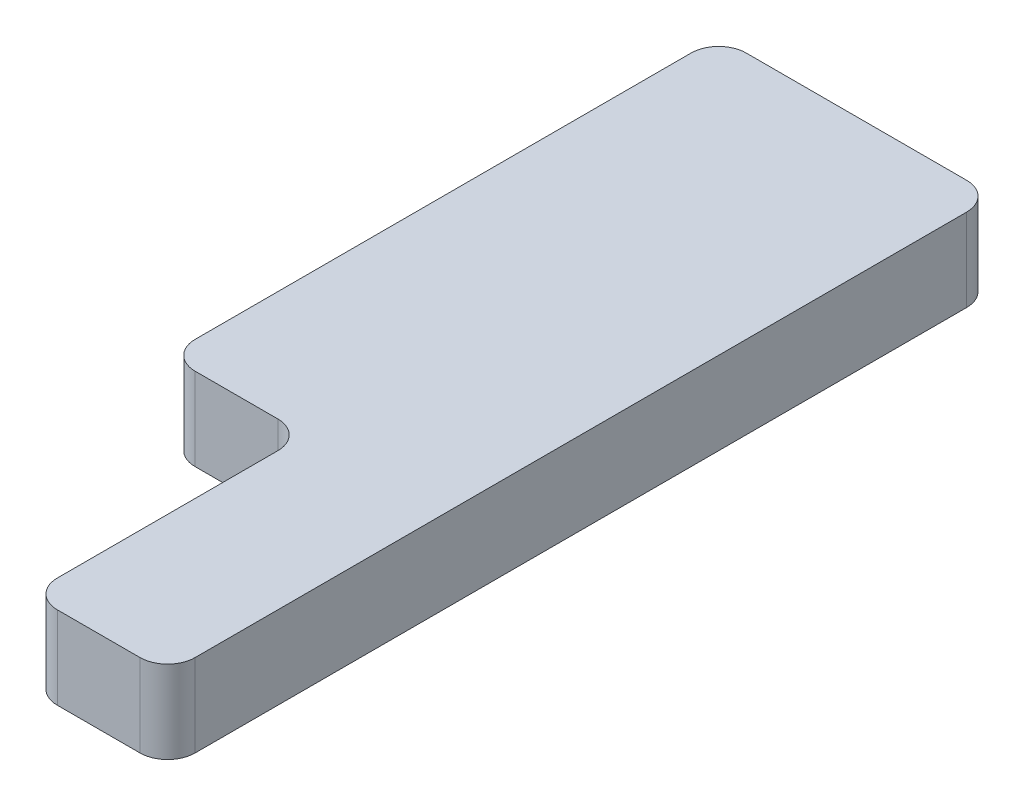
from build123d import *

# Parameters (mm, degrees)
ESBO_O1_W                = 10
ESBO_O1_H                = 30
RESSALTO_EXTRUS_O1_DEPTH = 3
ESBO_O2_W                = 5
ESBO_O2_H                = 10
CORTE_EXTRUS_O1_DEPTH    = 3
FILETE1_R                = 1
FILETE2_R                = 1
FILETE3_R                = 1
FILETE4_R                = 1
FILETE5_R                = 1
FILETE6_R                = 1


with BuildPart() as part:
    # Esboço1 → Ressalto-extrusão1 (new body)
    with BuildSketch(Plane(origin=(0, 0, 0), x_dir=(1, 0, 0), z_dir=(0, 1, 0))):
        Rectangle(ESBO_O1_W, ESBO_O1_H)
    extrude(amount=RESSALTO_EXTRUS_O1_DEPTH)

    # Esboço2 → Corte-extrusão1 (cut)
    with BuildSketch(Plane(origin=(0, 3, 0), x_dir=(1, 0, 0), z_dir=(0, 1, 0))):
        with Locations((-2.5, -10)):
            Rectangle(ESBO_O2_W, ESBO_O2_H)
    extrude(amount=-CORTE_EXTRUS_O1_DEPTH, mode=Mode.SUBTRACT)

    # Filete1
    filete1_edges = [part.edges().sort_by_distance(p)[0] for p in [
        (5, 1.5, 15),
    ]]
    fillet(filete1_edges, radius=FILETE1_R)

    # Filete2
    filete2_edges = [part.edges().sort_by_distance(p)[0] for p in [
        (0, 1.5, 15),
    ]]
    fillet(filete2_edges, radius=FILETE2_R)

    # Filete3
    filete3_edges = [part.edges().sort_by_distance(p)[0] for p in [
        (0, 1.5, 5),
    ]]
    fillet(filete3_edges, radius=FILETE3_R)

    # Filete4
    filete4_edges = [part.edges().sort_by_distance(p)[0] for p in [
        (-5, 1.5, 5),
    ]]
    fillet(filete4_edges, radius=FILETE4_R)

    # Filete5
    filete5_edges = [part.edges().sort_by_distance(p)[0] for p in [
        (-5, 1.5, -15),
    ]]
    fillet(filete5_edges, radius=FILETE5_R)

    # Filete6
    filete6_edges = [part.edges().sort_by_distance(p)[0] for p in [
        (5, 1.5, -15),
    ]]
    fillet(filete6_edges, radius=FILETE6_R)


solid = part.part
